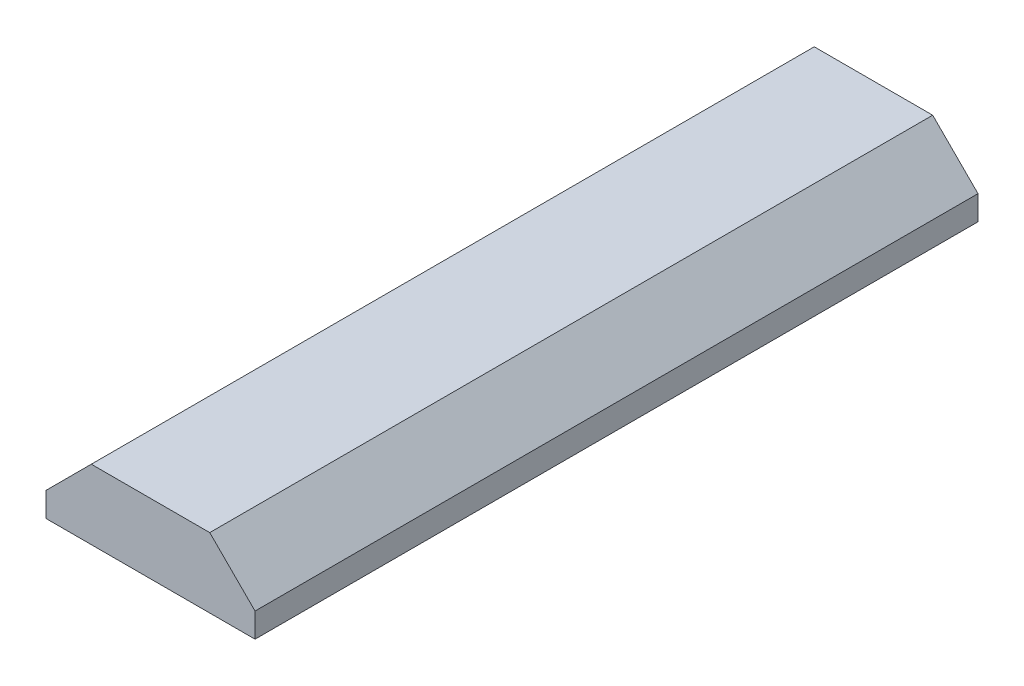
from build123d import *

# Parameters (mm, degrees)
AUFSATZ_LINEAR_AUSTRAGEN1_DEPTH = 41.5


with BuildPart() as part:
    # Skizze1 → Aufsatz-Linear austragen1 (new body)
    with BuildSketch(Plane.XY):
        Polygon((3.4, 1.808858787), (-3.4, 1.808858787), (-6, -0.791141213), (-6, -2.191141213), (6, -2.191141213), (6, -0.791141213), align=None)
    extrude(amount=AUFSATZ_LINEAR_AUSTRAGEN1_DEPTH)


solid = part.part
